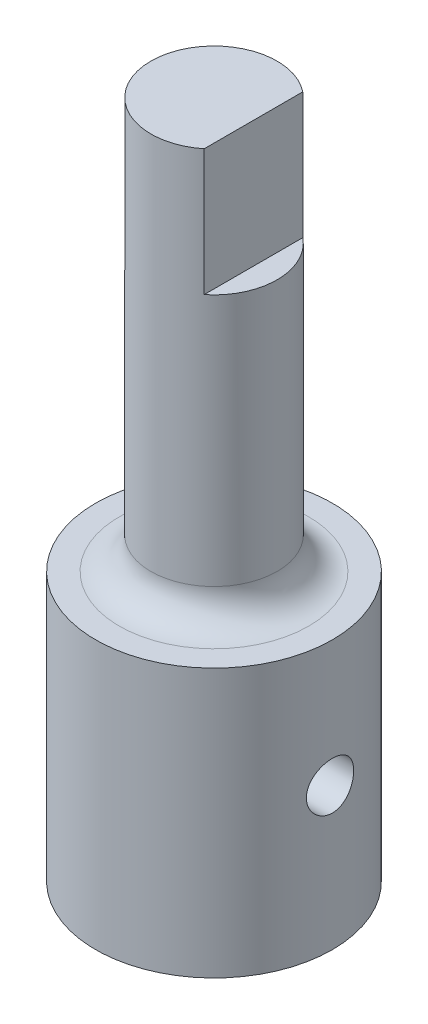
from build123d import *

# Parameters (mm, degrees)
CONG_1_R                = 2
ESQUISSE2_W             = 1.5
ESQUISSE2_H             = 6.244997998
ENL_V_MAT_EXTRU_1_DEPTH = 8
ESQUISSE3_R             = 1.5
ENL_V_MAT_EXTRU_2_DEPTH = 45.288824776


with BuildPart() as part:
    # Esquisse1 → Révolution1 (revolve)
    with BuildSketch(Plane.XY, mode=Mode.PRIVATE) as r_volution1_sk:
        Polygon((0, 0), (4, 0), (4, -26), (7.5, -26), (7.5, -43), (3, -43), (3, -29), (0, -26), align=None)
    revolve(r_volution1_sk.sketch.rotate(Axis((0, -26, 0), (0, -1, 0)), 180), axis=Axis((0, -26, 0), (0, -1, 0)))

    # Congé1
    cong_1_edges = [part.edges().sort_by_distance(p)[0] for p in [
        (4, -26, 0),
    ]]
    fillet(cong_1_edges, radius=CONG_1_R)

    # Esquisse2 → Enlèv. mat.-Extru.1 (cut)
    with BuildSketch(Plane(origin=(0, 0, 0), x_dir=(1, 0, 0), z_dir=(0, 1, 0))):
        with Locations((3.25, 0)):
            Rectangle(ESQUISSE2_W, ESQUISSE2_H)
    extrude(amount=-ENL_V_MAT_EXTRU_1_DEPTH, mode=Mode.SUBTRACT)

    # Esquisse3 → Enlèv. mat.-Extru.2 (cut, through all)
    with BuildSketch(Plane(origin=(0, 0, 0), x_dir=(0, 0, -1), z_dir=(1, 0, 0))):
        with Locations(Location((0, -34, 0), (0, 0, 180))):
            Circle(ESQUISSE3_R)
    extrude(amount=ENL_V_MAT_EXTRU_2_DEPTH, mode=Mode.SUBTRACT)


solid = part.part
